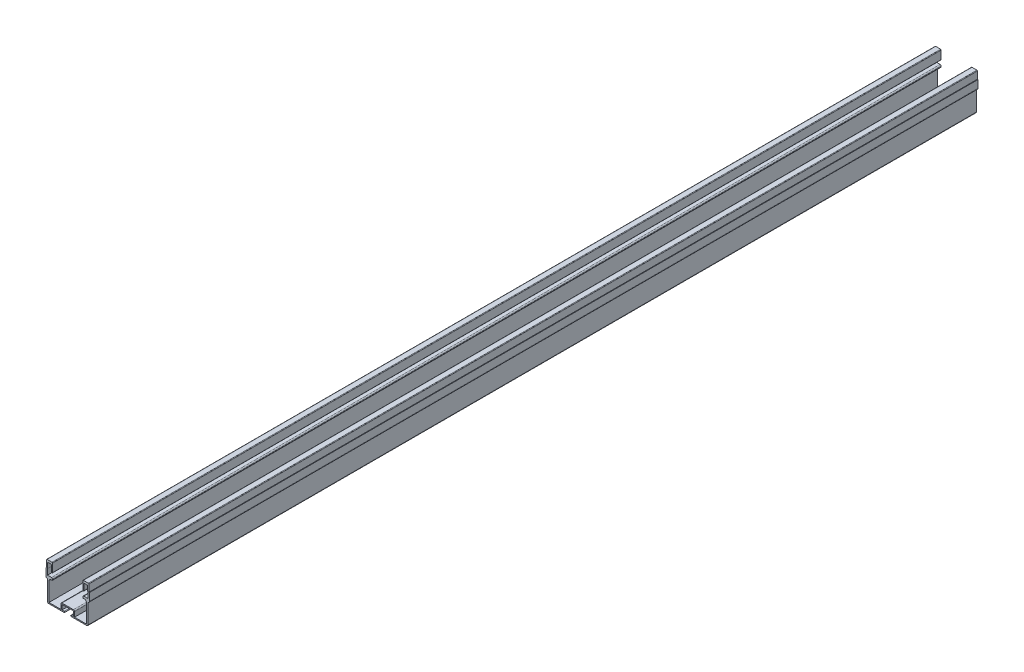
from build123d import *

# Parameters (mm, degrees)
EXTRUDE_1_DEPTH      = 406.5
EXTRUDE_1_DEPTH_BACK = 406.5


with BuildPart() as part:
    # 草图1 → 凸台-拉伸1 (new, two sides: drawn at the far end of the back side and taken through both)
    with BuildSketch(Plane.XY.offset(-EXTRUDE_1_DEPTH_BACK)):
        with BuildLine():
            Line((24.75, 1), (24.75, 5.5))
            ThreePointArc((24.75, 5.5), (24.457106781, 6.207106781), (23.75, 6.5))
            Line((23.75, 6.5), (18.5, 6.5))
            Line((18.5, 6.5), (13.25, 6.5))
            ThreePointArc((13.25, 6.5), (12.542893219, 6.207106781), (12.25, 5.5))
            Line((12.25, 5.5), (12.25, 1))
            Line((12.25, 1), (1.35, 1))
            Line((1.35, 1), (1.35, 18))
            ThreePointArc((1.35, 18), (1.935786438, 19.414213562), (3.35, 20))
            Line((3.35, 20), (4.15, 20))
            ThreePointArc((4.15, 20), (4.503553391, 20.146446609), (4.65, 20.5))
            Line((4.65, 20.5), (4.65, 21))
            ThreePointArc((4.65, 21), (4.357106781, 21.707106781), (3.65, 22))
            Line((3.65, 22), (0.05, 22))
            Line((0.05, 22), (0.05, 27.351174762))
            Line((0.05, 27.351174762), (0.25, 27.351174762))
            Line((0.25, 27.351174762), (0.25, 32.3))
            Line((0.25, 32.3), (3.65, 32.3))
            Line((3.65, 32.3), (3.65, 26.3))
            ThreePointArc((3.65, 26.3), (4.15, 25.8), (4.65, 26.3))
            Line((4.65, 26.3), (4.65, 33.8))
            ThreePointArc((4.65, 33.8), (4.503553391, 34.153553391), (4.15, 34.3))
            Line((4.15, 34.3), (-0.35, 34.3))
            ThreePointArc((-0.35, 34.3), (-0.703553391, 34.153553391), (-0.85, 33.8))
            Line((-0.85, 33.8), (-0.85, 27.351174762))
            Line((-0.85, 27.351174762), (-1.35, 27.351174762))
            Line((-1.35, 27.351174762), (-1.35, 20.450932326))
            ThreePointArc((-1.35, 20.450932326), (-0.954594155, 19.496338171), (0, 19.100932326))
            Line((0, 19.100932326), (0, 1))
            ThreePointArc((0, 1), (0.292893219, 0.292893219), (1, 0))
            Line((1, 0), (15.25, 0))
            ThreePointArc((15.25, 0), (15.75, 0.5), (15.25, 1))
            Line((15.25, 1), (13.25, 1))
            Line((13.25, 1), (13.25, 5.5))
            Line((13.25, 5.5), (18.5, 5.5))
            Line((18.5, 5.5), (23.75, 5.5))
            Line((23.75, 5.5), (23.75, 1))
            Line((23.75, 1), (21.75, 1))
            ThreePointArc((21.75, 1), (21.25, 0.5), (21.75, 0))
            Line((21.75, 0), (36, 0))
            ThreePointArc((36, 0), (36.707106781, 0.292893219), (37, 1))
            Line((37, 1), (37, 19.100932326))
            ThreePointArc((37, 19.100932326), (37.954594155, 19.496338171), (38.35, 20.450932326))
            Line((38.35, 20.450932326), (38.35, 27.351174762))
            Line((38.35, 27.351174762), (37.85, 27.351174762))
            Line((37.85, 27.351174762), (37.85, 33.8))
            ThreePointArc((37.85, 33.8), (37.703553391, 34.153553391), (37.35, 34.3))
            Line((37.35, 34.3), (32.85, 34.3))
            ThreePointArc((32.85, 34.3), (32.496446609, 34.153553391), (32.35, 33.8))
            Line((32.35, 33.8), (32.35, 26.3))
            ThreePointArc((32.35, 26.3), (32.85, 25.8), (33.35, 26.3))
            Line((33.35, 26.3), (33.35, 32.3))
            Line((33.35, 32.3), (36.75, 32.3))
            Line((36.75, 32.3), (36.75, 27.351174762))
            Line((36.75, 27.351174762), (36.95, 27.351174762))
            Line((36.95, 27.351174762), (36.95, 22))
            Line((36.95, 22), (33.35, 22))
            ThreePointArc((33.35, 22), (32.642893219, 21.707106781), (32.35, 21))
            Line((32.35, 21), (32.35, 20.5))
            ThreePointArc((32.35, 20.5), (32.496446609, 20.146446609), (32.85, 20))
            Line((32.85, 20), (33.65, 20))
            ThreePointArc((33.65, 20), (35.064213562, 19.414213562), (35.65, 18))
            Line((35.65, 18), (35.65, 1))
            Line((35.65, 1), (24.75, 1))
        make_face()
    extrude(amount=EXTRUDE_1_DEPTH + EXTRUDE_1_DEPTH_BACK)


solid = part.part
